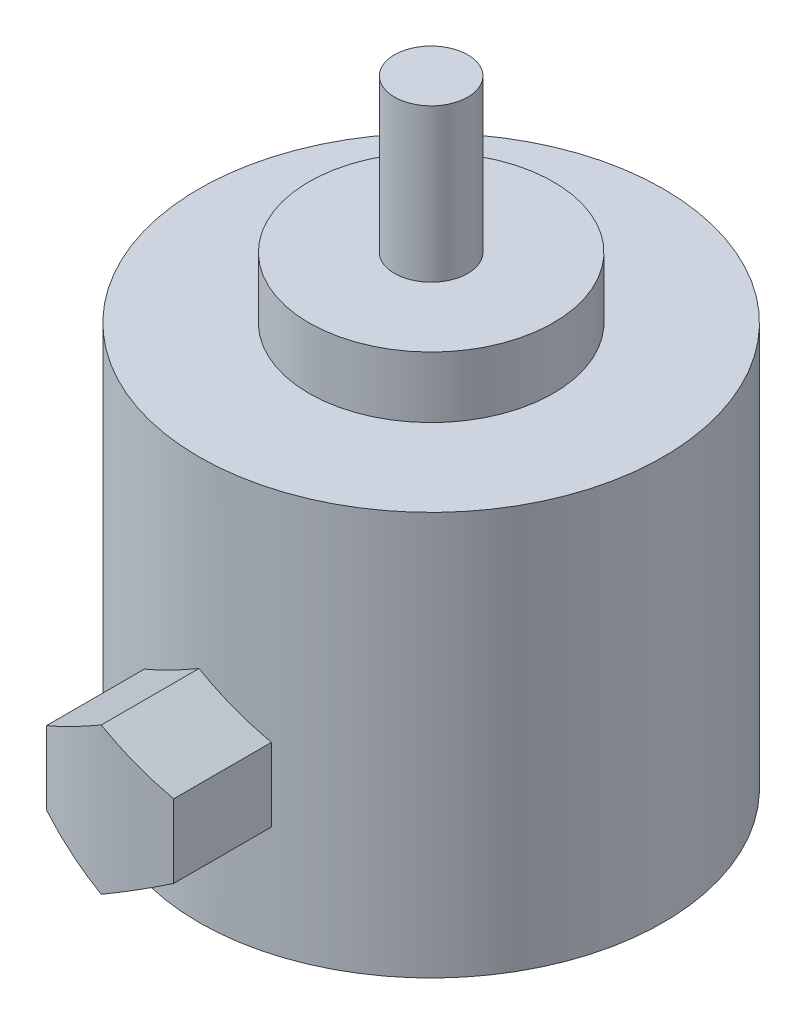
from build123d import *

# Parameters (mm, degrees)
CROQUIS1_R                     = 19
SALIENTE_EXTRUIR1_DEPTH        = 33
CROQUIS2_R                     = 10
SALIENTE_EXTRUIR2_DEPTH        = 5
CROQUIS4_R                     = 3
SALIENTE_EXTRUIR3_DEPTH        = 12.5
SALIENTE_EXTRUIR4_REACH        = 67.204
SALIENTE_EXTRUIR4_START_RADIUS = 19
SALIENTE_EXTRUIR4_END_RADIUS   = 19


with BuildPart() as part:
    # Croquis1 → Saliente-Extruir1 (new body)
    with BuildSketch(Plane(origin=(0, 0, 0), x_dir=(1, 0, 0), z_dir=(0, 1, 0))):
        with Locations(Location((0, 0, 0), (0, 0, 270))):
            Circle(CROQUIS1_R)
    extrude(amount=SALIENTE_EXTRUIR1_DEPTH)

    # Croquis2 → Saliente-Extruir2 (add)
    with BuildSketch(Plane(origin=(0, 33, 0), x_dir=(1, 0, 0), z_dir=(0, 1, 0))):
        with Locations(Location((0, 0, 0), (0, 0, 270))):
            Circle(CROQUIS2_R)
    extrude(amount=SALIENTE_EXTRUIR2_DEPTH)

    # Croquis4 → Saliente-Extruir3 (add)
    with BuildSketch(Plane(origin=(0, 38, 0), x_dir=(1, 0, 0), z_dir=(0, 1, 0))):
        with Locations(Location((0, 0, 0), (0, 0, 270))):
            Circle(CROQUIS4_R)
    extrude(amount=SALIENTE_EXTRUIR3_DEPTH)

    # Saliente-Extruir4: from a cylinder face, 67.204 long prism both ways, kept between that surface and its translate by the depth
    saliente_extruir4_start = Plane(origin=(0, 12, 0), z_dir=(0, -1, 0)) * Cylinder(SALIENTE_EXTRUIR4_START_RADIUS, 173.408, mode=Mode.PRIVATE)
    saliente_extruir4_end = Plane(origin=(0, 12, 8), z_dir=(0, -1, 0)) * Cylinder(SALIENTE_EXTRUIR4_END_RADIUS, 173.408, mode=Mode.PRIVATE)
    # Croquis6 → Saliente-Extruir4 (add, from a surface)
    with BuildSketch(Plane.XY, mode=Mode.PRIVATE) as saliente_extruir4_sk1:
        Polygon((-5.196152423, 15), (-5.196152423, 9), (0, 6), (5.196152423, 9), (5.196152423, 15), (0, 18), align=None)
    saliente_extruir4_tool1 = extrude(saliente_extruir4_sk1.sketch, amount=SALIENTE_EXTRUIR4_REACH, both=True, mode=Mode.PRIVATE)
    add(((saliente_extruir4_tool1 - saliente_extruir4_start) & saliente_extruir4_end).solids().sort_by_distance((0, 12, 22.637833))[0])


solid = part.part
